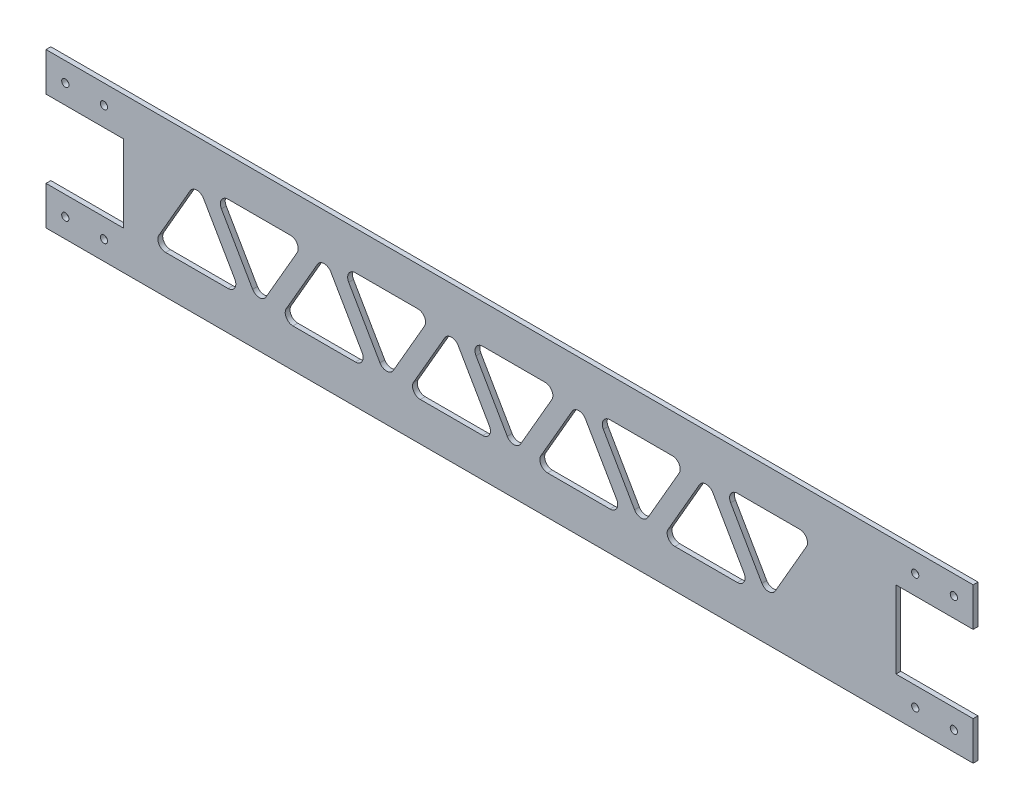
from build123d import *

# Parameters (mm, degrees)
SKETCH1_W           = 609.6
SKETCH1_H           = 101.6
BOSS_EXTRUDE1_DEPTH = 3.175
SKETCH2_R           = 2.38125
CUT_EXTRUDE1_DEPTH  = 310.020647571
CUT_EXTRUDE2_DEPTH  = 310.020647571
FILLET1_R           = 5.08
SKETCH4_W           = 50.8
SKETCH4_H           = 50.8
CUT_EXTRUDE3_DEPTH  = 310.020647571


with BuildPart() as part:
    # Sketch1 → Boss-Extrude1 (new body)
    with BuildSketch(Plane.XY):
        Rectangle(SKETCH1_W, SKETCH1_H)
    extrude(amount=BOSS_EXTRUDE1_DEPTH)

    # Sketch2 → Cut-Extrude1 (cut, through all)
    with BuildSketch(Plane.XY.offset(3.175)):
        with Locations((-292.1, 38.1)):
            Circle(SKETCH2_R)
        with Locations((-292.1, -38.1)):
            Circle(SKETCH2_R)
        with Locations((-266.7, 38.1)):
            Circle(SKETCH2_R)
        with Locations((-266.7, -38.1)):
            Circle(SKETCH2_R)
        with Locations((-292.1, -19.05)):
            Circle(SKETCH2_R)
        with Locations((-266.7, -19.05)):
            Circle(SKETCH2_R)
        with Locations(Location((266.7, -19.05, 0), (0, 0, 180))):
            Circle(SKETCH2_R)
        with Locations(Location((292.1, -19.05, 0), (0, 0, 180))):
            Circle(SKETCH2_R)
        with Locations(Location((266.7, -38.1, 0), (0, 0, 180))):
            Circle(SKETCH2_R)
        with Locations(Location((266.7, 38.1, 0), (0, 0, 180))):
            Circle(SKETCH2_R)
        with Locations(Location((292.1, -38.1, 0), (0, 0, 180))):
            Circle(SKETCH2_R)
        with Locations(Location((292.1, 38.1, 0), (0, 0, 180))):
            Circle(SKETCH2_R)
    extrude(amount=-CUT_EXTRUDE1_DEPTH, mode=Mode.SUBTRACT)

    # Sketch3 → Cut-Extrude2 (cut, through all)
    with BuildSketch(Plane.XY.offset(3.175)):
        Polygon((-176.29121265, -25.4), (-205.620606325, 25.4), (-234.95, -25.4), align=None)
        Polygon((-164.55945518, -25.4), (-135.230061506, 25.4), (-193.888848855, 25.4), align=None)
        Polygon((-92.583618834, -25.4), (-121.913012509, 25.4), (-151.242406183, -25.4), align=None)
        Polygon((-80.851861364, -25.4), (-51.522467689, 25.4), (-110.181255039, 25.4), align=None)
        Polygon((-8.876025017, -25.4), (-38.205418692, 25.4), (-67.534812367, -25.4), align=None)
        Polygon((2.855732453, -25.4), (32.185126128, 25.4), (-26.473661222, 25.4), align=None)
        Polygon((74.8315688, -25.4), (45.502175125, 25.4), (16.17278145, -25.4), align=None)
        Polygon((86.563326269, -25.4), (115.892719944, 25.4), (57.233932595, 25.4), align=None)
        Polygon((158.539162616, -25.4), (129.209768941, 25.4), (99.880375267, -25.4), align=None)
        Polygon((170.270920086, -25.4), (199.600313761, 25.4), (140.941526411, 25.4), align=None)
    extrude(amount=-CUT_EXTRUDE2_DEPTH, mode=Mode.SUBTRACT)

    # Fillet1
    fillet1_edges = [part.edges().sort_by_distance(p)[0] for p in [
        (74.8315688, -25.4, 1.5875),
        (16.17278145, -25.4, 1.5875),
        (45.502175125, 25.4, 1.5875),
        (2.855732453, -25.4, 1.5875),
        (-26.473661222, 25.4, 1.5875),
        (32.185126128, 25.4, 1.5875),
        (158.539162616, -25.4, 1.5875),
        (99.880375267, -25.4, 1.5875),
        (129.209768941, 25.4, 1.5875),
        (86.563326269, -25.4, 1.5875),
        (57.233932595, 25.4, 1.5875),
        (115.892719944, 25.4, 1.5875),
        (-92.583618834, -25.4, 1.5875),
        (-151.242406183, -25.4, 1.5875),
        (-121.913012509, 25.4, 1.5875),
        (-164.55945518, -25.4, 1.5875),
        (-193.888848855, 25.4, 1.5875),
        (-135.230061506, 25.4, 1.5875),
        (-8.876025017, -25.4, 1.5875),
        (-67.534812367, -25.4, 1.5875),
        (-38.205418692, 25.4, 1.5875),
        (-80.851861364, -25.4, 1.5875),
        (-110.181255039, 25.4, 1.5875),
        (-51.522467689, 25.4, 1.5875),
        (170.270920086, -25.4, 1.5875),
        (140.941526411, 25.4, 1.5875),
        (199.600313761, 25.4, 1.5875),
        (-176.29121265, -25.4, 1.5875),
        (-234.95, -25.4, 1.5875),
        (-205.620606325, 25.4, 1.5875),
    ]]
    fillet(fillet1_edges, radius=FILLET1_R)

    # Sketch4 → Cut-Extrude3 (cut, through all)
    with BuildSketch(Plane.XY.offset(3.175)):
        with Locations((-279.4, 0)):
            Rectangle(SKETCH4_W, SKETCH4_H)
        with Locations((279.4, 0)):
            Rectangle(SKETCH4_W, SKETCH4_H)
    extrude(amount=-CUT_EXTRUDE3_DEPTH, mode=Mode.SUBTRACT)


solid = part.part
